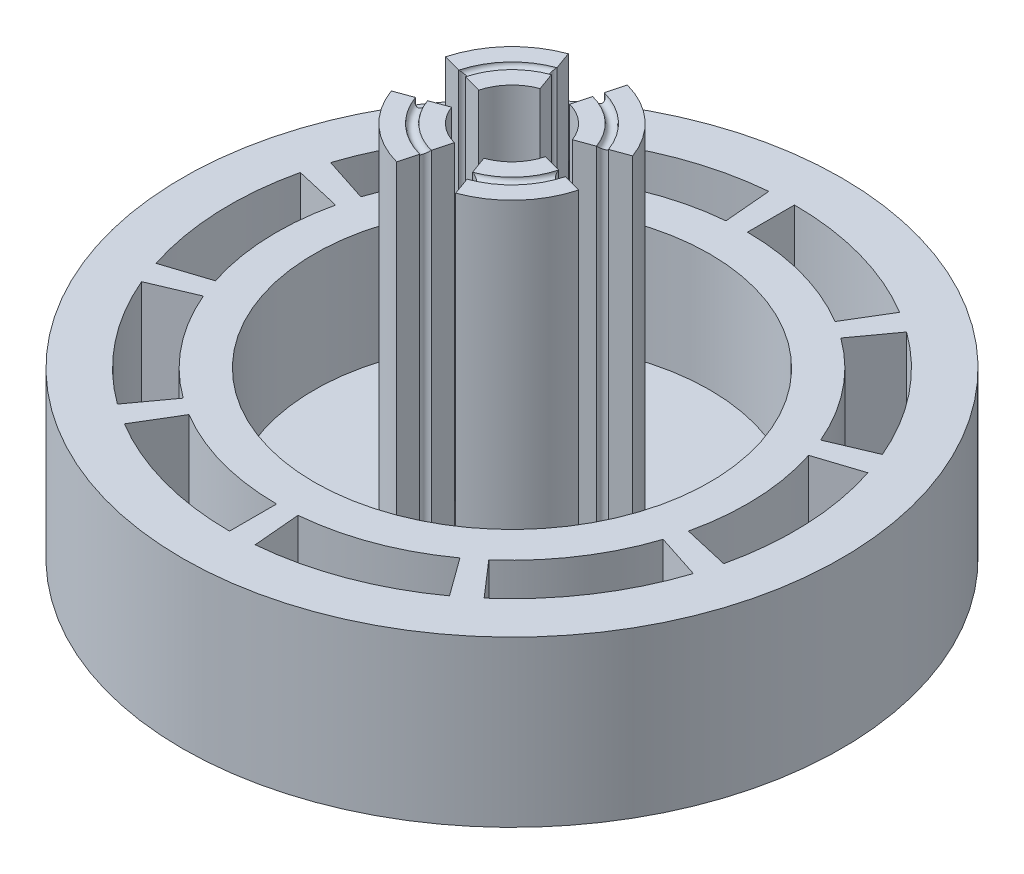
from build123d import *

# Parameters (mm, degrees)
SKETCH2_R             = 70
SKETCH2_R_2           = 42
BOSS_EXTRUDE2_DEPTH   = 35
BOSS_EXTRUDE3_DEPTH   = 80
BOSS_EXTRUDE3_2_DEPTH = 80
BOSS_EXTRUDE3_3_DEPTH = 80
BOSS_EXTRUDE3_4_DEPTH = 80
SKETCH1_R             = 50
SKETCH1_R_2           = 20
BOSS_EXTRUDE4_DEPTH   = 10
CUT_EXTRUDE1_REACH    = 129.279


with BuildPart() as part:
    # Sketch2 → Boss-Extrude2 (new body)
    with BuildSketch(Plane(origin=(0, 0, 0), x_dir=(1, 0, 0), z_dir=(0, 1, 0))):
        Circle(SKETCH2_R)
        Circle(SKETCH2_R_2, mode=Mode.SUBTRACT)
        with BuildLine():
            ThreePointArc((-25.751903746, -42.858365035), (-13.361918804, -48.18152266), (0, -50))
            Line((0, -50), (0, -60))
            ThreePointArc((0, -60), (-16.034302565, -57.817827193), (-30.902284495, -51.430038042))
            Line((-30.902284495, -51.430038042), (-25.751903746, -42.858365035))
        make_face(mode=Mode.SUBTRACT)
        with BuildLine():
            Line((-29.389262615, -40.450849719), (-35.267115138, -48.541019662))
            ThreePointArc((-35.267115138, -48.541019662), (-46.956489411, -37.350878198), (-55.230291207, -23.443867709))
            Line((-55.230291207, -23.443867709), (-46.025242673, -19.536556424))
            ThreePointArc((-46.025242673, -19.536556424), (-39.130407843, -31.125731832), (-29.389262615, -40.450849719))
        make_face(mode=Mode.SUBTRACT)
        with BuildLine():
            ThreePointArc((35.267115138, -48.541019662), (21.012442876, -56.200331355), (5.229344565, -59.771681886))
            Line((5.229344565, -59.771681886), (4.357787137, -49.809734905))
            ThreePointArc((4.357787137, -49.809734905), (17.510369063, -46.833609462), (29.389262615, -40.450849719))
            Line((29.389262615, -40.450849719), (35.267115138, -48.541019662))
        make_face(mode=Mode.SUBTRACT)
        with BuildLine():
            ThreePointArc((57.063390978, -18.541019662), (50.033149324, -33.116219119), (39.363541739, -45.282574813))
            Line((39.363541739, -45.282574813), (32.80295145, -37.735479011))
            ThreePointArc((32.80295145, -37.735479011), (41.694291103, -27.596849266), (47.552825815, -15.450849719))
            Line((47.552825815, -15.450849719), (57.063390978, -18.541019662))
        make_face(mode=Mode.SUBTRACT)
        with BuildLine():
            Line((58.462203887, -13.497063261), (48.718503239, -11.247552717))
            ThreePointArc((48.718503239, -11.247552717), (49.952411079, 2.180969368), (47.552825815, 15.450849719))
            Line((47.552825815, 15.450849719), (57.063390978, 18.541019662))
            ThreePointArc((57.063390978, 18.541019662), (59.942893295, 2.617163242), (58.462203887, -13.497063261))
        make_face(mode=Mode.SUBTRACT)
        with BuildLine():
            ThreePointArc((35.267115138, 48.541019662), (46.956489411, 37.350878198), (55.230291207, 23.443867709))
            Line((55.230291207, 23.443867709), (46.025242673, 19.536556424))
            ThreePointArc((46.025242673, 19.536556424), (39.130407843, 31.125731832), (29.389262615, 40.450849719))
            Line((29.389262615, 40.450849719), (35.267115138, 48.541019662))
        make_face(mode=Mode.SUBTRACT)
        with BuildLine():
            ThreePointArc((0, 60), (16.034302565, 57.817827193), (30.902284495, 51.430038042))
            Line((30.902284495, 51.430038042), (25.751903746, 42.858365035))
            ThreePointArc((25.751903746, 42.858365035), (13.361918804, 48.18152266), (0, 50))
            Line((0, 50), (0, 60))
        make_face(mode=Mode.SUBTRACT)
        with BuildLine():
            ThreePointArc((-35.267115138, 48.541019662), (-21.012442876, 56.200331355), (-5.229344565, 59.771681886))
            Line((-5.229344565, 59.771681886), (-4.357787137, 49.809734905))
            ThreePointArc((-4.357787137, 49.809734905), (-17.510369063, 46.833609462), (-29.389262615, 40.450849719))
            Line((-29.389262615, 40.450849719), (-35.267115138, 48.541019662))
        make_face(mode=Mode.SUBTRACT)
        with BuildLine():
            ThreePointArc((-57.063390978, 18.541019662), (-50.033149324, 33.116219119), (-39.363541739, 45.282574813))
            Line((-39.363541739, 45.282574813), (-32.80295145, 37.735479011))
            ThreePointArc((-32.80295145, 37.735479011), (-41.694291103, 27.596849266), (-47.552825815, 15.450849719))
            Line((-47.552825815, 15.450849719), (-57.063390978, 18.541019662))
        make_face(mode=Mode.SUBTRACT)
        with BuildLine():
            ThreePointArc((-57.063390978, -18.541019662), (-59.942893295, -2.617163242), (-58.462203887, 13.497063261))
            Line((-58.462203887, 13.497063261), (-48.718503239, 11.247552717))
            ThreePointArc((-48.718503239, 11.247552717), (-49.952411079, -2.180969368), (-47.552825815, -15.450849719))
            Line((-47.552825815, -15.450849719), (-57.063390978, -18.541019662))
        make_face(mode=Mode.SUBTRACT)
    extrude(amount=BOSS_EXTRUDE2_DEPTH)



with BuildPart() as body_2:
    # Sketch2<10> → Boss-Extrude3 (new body)
    with BuildSketch(Plane(origin=(0, 0, 0), x_dir=(1, 0, 0), z_dir=(0, 1, 0))):
        with BuildLine():
            ThreePointArc((-2.588190451, -9.659258263), (-6.755902076, -7.372773368), (-9.396926208, -3.420201433))
            Line((-9.396926208, -3.420201433), (-18.793852416, -6.840402867))
            ThreePointArc((-18.793852416, -6.840402867), (-13.511804152, -14.745546736), (-5.176380902, -19.318516526))
            Line((-5.176380902, -19.318516526), (-2.588190451, -9.659258263))
        make_face()
    extrude(amount=BOSS_EXTRUDE3_DEPTH)


with BuildPart() as body_3:
    # Sketch2<10> → Boss-Extrude3 2 (new body)
    with BuildSketch(Plane(origin=(0, 0, 0), x_dir=(1, 0, 0), z_dir=(0, 1, 0))):
        with BuildLine():
            ThreePointArc((9.659258263, -2.588190451), (7.372773368, -6.755902076), (3.420201433, -9.396926208))
            Line((3.420201433, -9.396926208), (6.840402867, -18.793852416))
            ThreePointArc((6.840402867, -18.793852416), (14.745546736, -13.511804152), (19.318516526, -5.176380902))
            Line((19.318516526, -5.176380902), (9.659258263, -2.588190451))
        make_face()
    extrude(amount=BOSS_EXTRUDE3_2_DEPTH)


with BuildPart() as body_4:
    # Sketch2<10> → Boss-Extrude3 3 (new body)
    with BuildSketch(Plane(origin=(0, 0, 0), x_dir=(1, 0, 0), z_dir=(0, 1, 0))):
        with BuildLine():
            Line((-19.318516526, 5.176380902), (-9.659258263, 2.588190451))
            ThreePointArc((-9.659258263, 2.588190451), (-7.372773368, 6.755902076), (-3.420201433, 9.396926208))
            Line((-3.420201433, 9.396926208), (-6.840402867, 18.793852416))
            ThreePointArc((-6.840402867, 18.793852416), (-14.745546736, 13.511804152), (-19.318516526, 5.176380902))
        make_face()
    extrude(amount=BOSS_EXTRUDE3_3_DEPTH)


with BuildPart() as body_5:
    # Sketch2<10> → Boss-Extrude3 4 (new body)
    with BuildSketch(Plane(origin=(0, 0, 0), x_dir=(1, 0, 0), z_dir=(0, 1, 0))):
        with BuildLine():
            Line((5.176380902, 19.318516526), (2.588190451, 9.659258263))
            ThreePointArc((2.588190451, 9.659258263), (6.755902076, 7.372773368), (9.396926208, 3.420201433))
            Line((9.396926208, 3.420201433), (18.793852416, 6.840402867))
            ThreePointArc((18.793852416, 6.840402867), (13.511804152, 14.745546736), (5.176380902, 19.318516526))
        make_face()
    extrude(amount=BOSS_EXTRUDE3_4_DEPTH)


with BuildPart() as part_1:
    add(part.part)

    add(body_2.part)  # Boss-Extrude4 merges body 2

    add(body_3.part)  # Boss-Extrude4 merges body 3

    add(body_4.part)  # Boss-Extrude4 merges body 4

    add(body_5.part)  # Boss-Extrude4 merges body 5
    # Sketch1 → Boss-Extrude4 (add)
    with BuildSketch(Plane(origin=(0, 0, 0), x_dir=(1, 0, 0), z_dir=(0, 1, 0))):
        Circle(SKETCH1_R)
        Circle(SKETCH1_R_2, mode=Mode.SUBTRACT)
    extrude(amount=BOSS_EXTRUDE4_DEPTH)

    # Sketch3 → Cut-Extrude1 (cut, up to next)
    with BuildSketch(Plane(origin=(0, 80, 0), x_dir=(1, 0, 0), z_dir=(0, 1, 0)), mode=Mode.PRIVATE) as cut_extrude1_sk1:
        with BuildLine():
            Line((13.522961568, -3.623466631), (15.454813221, -4.141104722))
            ThreePointArc((15.454813221, -4.141104722), (14.230068349, -4.848211503), (13.522961568, -3.623466631))
        make_face()
    cut_extrude1_tool1 = extrude(cut_extrude1_sk1.sketch, amount=-CUT_EXTRUDE1_REACH, mode=Mode.PRIVATE) & part_1.part
    # Sketch3 → Cut-Extrude1 (cut, up to next)
    with BuildSketch(Plane(origin=(0, 80, 0), x_dir=(1, 0, 0), z_dir=(0, 1, 0)), mode=Mode.PRIVATE) as cut_extrude1_sk2:
        with BuildLine():
            Line((-3.623466631, -13.522961568), (-4.141104722, -15.454813221))
            ThreePointArc((-4.141104722, -15.454813221), (-4.848211503, -14.230068349), (-3.623466631, -13.522961568))
        make_face()
    cut_extrude1_tool2 = extrude(cut_extrude1_sk2.sketch, amount=-CUT_EXTRUDE1_REACH, mode=Mode.PRIVATE) & part_1.part
    # Sketch3 → Cut-Extrude1 (cut, up to next)
    with BuildSketch(Plane(origin=(0, 80, 0), x_dir=(1, 0, 0), z_dir=(0, 1, 0)), mode=Mode.PRIVATE) as cut_extrude1_sk3:
        with BuildLine():
            Line((4.788282007, -13.155696691), (5.472322293, -15.035081933))
            ThreePointArc((5.472322293, -15.035081933), (6.069994771, -13.753369168), (4.788282007, -13.155696691))
        make_face()
    cut_extrude1_tool3 = extrude(cut_extrude1_sk3.sketch, amount=-CUT_EXTRUDE1_REACH, mode=Mode.PRIVATE) & part_1.part
    # Sketch3 → Cut-Extrude1 (cut, up to next)
    with BuildSketch(Plane(origin=(0, 80, 0), x_dir=(1, 0, 0), z_dir=(0, 1, 0)), mode=Mode.PRIVATE) as cut_extrude1_sk4:
        with BuildLine():
            Line((-13.155696691, -4.788282007), (-15.035081933, -5.472322293))
            ThreePointArc((-15.035081933, -5.472322293), (-13.753369168, -6.069994771), (-13.155696691, -4.788282007))
        make_face()
    cut_extrude1_tool4 = extrude(cut_extrude1_sk4.sketch, amount=-CUT_EXTRUDE1_REACH, mode=Mode.PRIVATE) & part_1.part
    # Sketch3 → Cut-Extrude1 (cut, up to next)
    with BuildSketch(Plane(origin=(0, 80, 0), x_dir=(1, 0, 0), z_dir=(0, 1, 0)), mode=Mode.PRIVATE) as cut_extrude1_sk5:
        with BuildLine():
            Line((-13.522961568, 3.623466631), (-15.454813221, 4.141104722))
            ThreePointArc((-15.454813221, 4.141104722), (-14.230068349, 4.848211503), (-13.522961568, 3.623466631))
        make_face()
    cut_extrude1_tool5 = extrude(cut_extrude1_sk5.sketch, amount=-CUT_EXTRUDE1_REACH, mode=Mode.PRIVATE) & part_1.part
    # Sketch3 → Cut-Extrude1 (cut, up to next)
    with BuildSketch(Plane(origin=(0, 80, 0), x_dir=(1, 0, 0), z_dir=(0, 1, 0)), mode=Mode.PRIVATE) as cut_extrude1_sk6:
        with BuildLine():
            Line((-4.788282007, 13.155696691), (-5.472322293, 15.035081933))
            ThreePointArc((-5.472322293, 15.035081933), (-6.069994771, 13.753369168), (-4.788282007, 13.155696691))
        make_face()
    cut_extrude1_tool6 = extrude(cut_extrude1_sk6.sketch, amount=-CUT_EXTRUDE1_REACH, mode=Mode.PRIVATE) & part_1.part
    # Sketch3 → Cut-Extrude1 (cut, up to next)
    with BuildSketch(Plane(origin=(0, 80, 0), x_dir=(1, 0, 0), z_dir=(0, 1, 0)), mode=Mode.PRIVATE) as cut_extrude1_sk7:
        with BuildLine():
            Line((3.623466631, 13.522961568), (4.141104722, 15.454813221))
            ThreePointArc((4.141104722, 15.454813221), (4.848211503, 14.230068349), (3.623466631, 13.522961568))
        make_face()
    cut_extrude1_tool7 = extrude(cut_extrude1_sk7.sketch, amount=-CUT_EXTRUDE1_REACH, mode=Mode.PRIVATE) & part_1.part
    # Sketch3 → Cut-Extrude1 (cut, up to next)
    with BuildSketch(Plane(origin=(0, 80, 0), x_dir=(1, 0, 0), z_dir=(0, 1, 0)), mode=Mode.PRIVATE) as cut_extrude1_sk8:
        with BuildLine():
            Line((13.155696691, 4.788282007), (15.035081933, 5.472322293))
            ThreePointArc((15.035081933, 5.472322293), (13.753369168, 6.069994771), (13.155696691, 4.788282007))
        make_face()
    cut_extrude1_tool8 = extrude(cut_extrude1_sk8.sketch, amount=-CUT_EXTRUDE1_REACH, mode=Mode.PRIVATE) & part_1.part
    add(cut_extrude1_tool1.solids().sort_by_distance((14.379041, 80, 4.292237))[0], mode=Mode.SUBTRACT)
    add(cut_extrude1_tool2.solids().sort_by_distance((-4.292237, 80, 14.379041))[0], mode=Mode.SUBTRACT)
    add(cut_extrude1_tool3.solids().sort_by_distance((5.52912, 80, 13.950231))[0], mode=Mode.SUBTRACT)
    add(cut_extrude1_tool4.solids().sort_by_distance((-13.950231, 80, 5.52912))[0], mode=Mode.SUBTRACT)
    add(cut_extrude1_tool5.solids().sort_by_distance((-14.379041, 80, -4.292237))[0], mode=Mode.SUBTRACT)
    add(cut_extrude1_tool6.solids().sort_by_distance((-5.52912, 80, -13.950231))[0], mode=Mode.SUBTRACT)
    add(cut_extrude1_tool7.solids().sort_by_distance((4.292237, 80, -14.379041))[0], mode=Mode.SUBTRACT)
    add(cut_extrude1_tool8.solids().sort_by_distance((13.950231, 80, -5.52912))[0], mode=Mode.SUBTRACT)

    # Sketch5 → Cut-Revolve1 (revolve, cut)
    with BuildSketch(Plane(origin=(0, 0, 0), x_dir=(0.2588190451025142, 0, -0.9659258262890701), z_dir=(0.9659258262890701, 0, 0.2588190451025142))):
        with BuildLine():
            ThreePointArc((-16, 80), (-15, 79), (-14, 80))
            Line((-14, 80), (-16, 80))
        make_face()
    revolve(axis=Axis((0, 80, 0), (0, -1, 0)), mode=Mode.SUBTRACT)


solid = part_1.part
